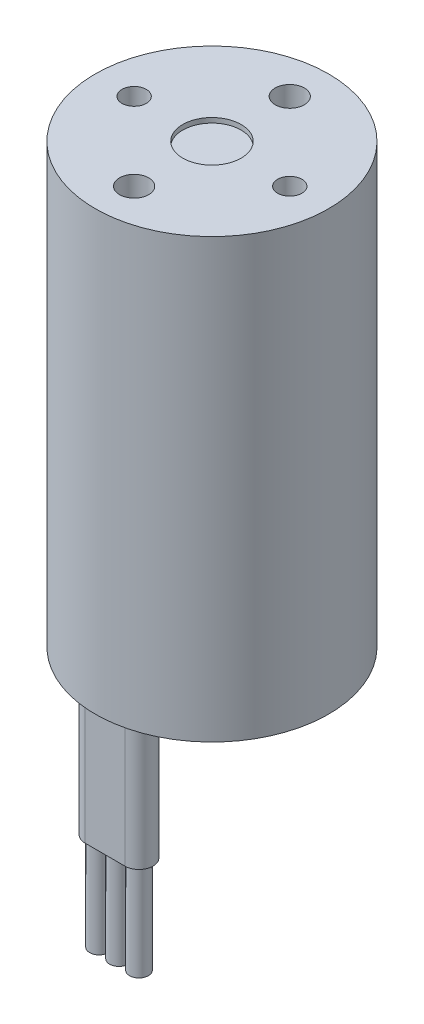
from build123d import *

# Parameters (mm, degrees)
SKETCH1_R              = 12
MOTORCASE_DEPTH        = 45
HOLE_WIZARD_M2_5_D     = 2.5
HOLE_WIZARD_M2_5_DEPTH = 4
HOLE_WIZARD_M2_5_TIP   = 0.751075774
HOLE_WIZARD_M3_D       = 3
HOLE_WIZARD_M3_DEPTH   = 4
HOLE_WIZARD_M3_TIP     = 0.901290929
BOSS_EXTRUDE1_DEPTH    = 13
SKETCH15_R             = 0.966568062
BOSS_EXTRUDE2_DEPTH    = 10
SKETCH16_R             = 3
CUT_EXTRUDE2_DEPTH     = 0.5
CUT_EXTRUDE3_START     = -0.5
SKETCH17_R             = 3
CUT_EXTRUDE3_DEPTH     = 0.5


with BuildPart() as part:
    # Sketch1 → MotorCase (new body)
    with BuildSketch(Plane(origin=(0, 0, 0), x_dir=(1, 0, 0), z_dir=(0, 1, 0))):
        with Locations(Location((0, 0, 0), (0, 0, 90))):
            Circle(SKETCH1_R)
    extrude(amount=MOTORCASE_DEPTH)

    # Hole Wizard M2.5
    with Locations(Plane(origin=(0, 45, 0), x_dir=(1, 0, 0), z_dir=(0, 1, 0))):
        with Locations((8, 0), (-8, 0)):
            Hole(HOLE_WIZARD_M2_5_D / 2, depth=HOLE_WIZARD_M2_5_DEPTH)
            with Locations((0, 0, -(HOLE_WIZARD_M2_5_DEPTH + HOLE_WIZARD_M2_5_TIP / 2))):  # 118° drill point
                Cone(0, HOLE_WIZARD_M2_5_D / 2, HOLE_WIZARD_M2_5_TIP, mode=Mode.SUBTRACT)

    # Hole Wizard M3
    with Locations(Plane(origin=(0, 45, 0), x_dir=(1, 0, 0), z_dir=(0, 1, 0))):
        with Locations((0, 8), (0, -8)):
            Hole(HOLE_WIZARD_M3_D / 2, depth=HOLE_WIZARD_M3_DEPTH)
            with Locations((0, 0, -(HOLE_WIZARD_M3_DEPTH + HOLE_WIZARD_M3_TIP / 2))):  # 118° drill point
                Cone(0, HOLE_WIZARD_M3_D / 2, HOLE_WIZARD_M3_TIP, mode=Mode.SUBTRACT)

    # Sketch14 → Boss-Extrude1 (add)
    with BuildSketch(Plane.XZ):
        with BuildLine():
            Line((-2.053579932, 11), (2.053579932, 11))
            ThreePointArc((2.053579932, 11), (3.5, 9.553579932), (2.053579932, 8.107159865))
            Line((2.053579932, 8.107159865), (-2.053579932, 8.107159865))
            ThreePointArc((-2.053579932, 8.107159865), (-3.5, 9.553579932), (-2.053579932, 11))
        make_face()
    extrude(amount=BOSS_EXTRUDE1_DEPTH)

    # Sketch15 → Boss-Extrude2 (add)
    with BuildSketch(Plane.XZ.offset(13)):
        with Locations(Location((-2.053579932, 9.553579932, 0), (0, 0, 270))):
            Circle(SKETCH15_R)
        with Locations(Location((0, 9.553579932, 0), (0, 0, 270))):
            Circle(SKETCH15_R)
        with Locations(Location((2.053579932, 9.553579932, 0), (0, 0, 270))):
            Circle(SKETCH15_R)
    extrude(amount=BOSS_EXTRUDE2_DEPTH)

    # Sketch16 → Cut-Extrude2 (cut)
    with BuildSketch(Plane.XZ):
        with Locations(Location((0, 0, 0), (0, 0, 270))):
            Circle(SKETCH16_R)
    extrude(amount=-CUT_EXTRUDE2_DEPTH, mode=Mode.SUBTRACT)

    # Sketch17 → Cut-Extrude3 (cut)
    with BuildSketch(Plane(origin=(0, 45, 0), x_dir=(1, 0, 0), z_dir=(0, 1, 0)).offset(CUT_EXTRUDE3_START)):
        with Locations(Location((0, 0, 0), (0, 0, 90))):
            Circle(SKETCH17_R)
    extrude(amount=CUT_EXTRUDE3_DEPTH, mode=Mode.SUBTRACT)


solid = part.part
